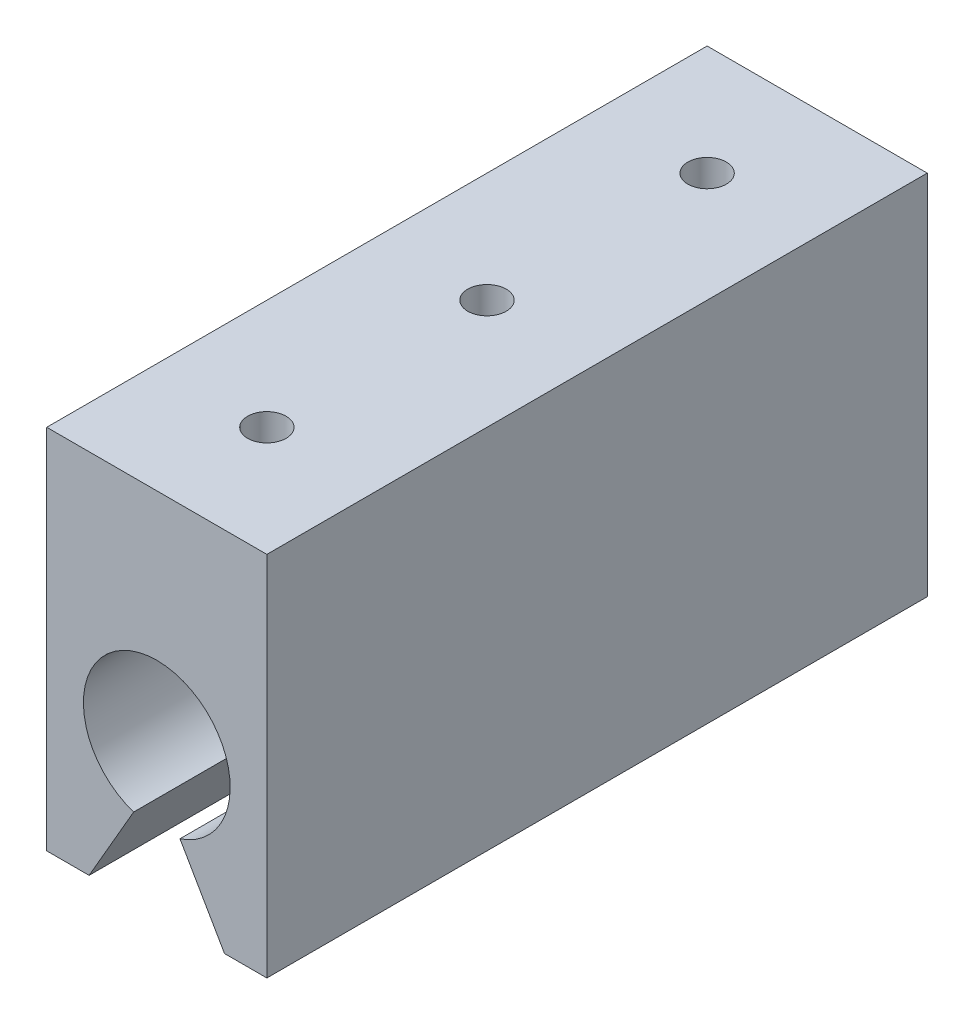
from build123d import *

# Parameters (mm, degrees)
BOSS_EXTRUDE1_DEPTH     = 114.3
SKETCH2_R               = 3.3274
CUT_EXTRUDE1_DEPTH      = 133.134940496
CUT_EXTRUDE2_REACH      = 128.523
CUT_EXTRUDE2_END_RADIUS = 12.7
SKETCH3_R               = 6.35


with BuildPart() as part:
    # Sketch1 → Boss-Extrude1 (new body)
    with BuildSketch(Plane.XY):
        with BuildLine():
            Line((4.010170085, 26.049749551), (11.717651581, 12.7))
            Line((11.717651581, 12.7), (19.05, 12.7))
            Line((19.05, 12.7), (19.05, 76.2))
            Line((19.05, 76.2), (-19.05, 76.2))
            Line((-19.05, 76.2), (-19.05, 12.7))
            Line((-19.05, 12.7), (-11.717651581, 12.7))
            Line((-11.717651581, 12.7), (-4.010170085, 26.049749551))
            ThreePointArc((-4.010170085, 26.049749551), (0, 50.8), (4.010170085, 26.049749551))
        make_face()
    extrude(amount=BOSS_EXTRUDE1_DEPTH)

    # Sketch2 → Cut-Extrude1 (cut, through all)
    with BuildSketch(Plane(origin=(0, 76.2, 0), x_dir=(1, 0, 0), z_dir=(0, 1, 0))):
        with Locations(Location((0, -19.05, 0), (0, 0, 270))):
            Circle(SKETCH2_R)
        with Locations(Location((0, -57.15, 0), (0, 0, 270))):
            Circle(SKETCH2_R)
        with Locations(Location((0, -95.25, 0), (0, 0, 270))):
            Circle(SKETCH2_R)
    extrude(amount=-CUT_EXTRUDE1_DEPTH, mode=Mode.SUBTRACT)

    # Cut-Extrude2: up to this cylinder (the profile starts outside it)
    cut_extrude2_end = Plane(origin=(0, 38.1, 57.15), z_dir=(0, 0, -1)) * Cylinder(CUT_EXTRUDE2_END_RADIUS, 359.646, mode=Mode.PRIVATE)
    # Sketch3 → Cut-Extrude2 (cut, up to the surface)
    with BuildSketch(Plane(origin=(0, 63.5, 0), x_dir=(1, 0, 0), z_dir=(0, 1, 0)), mode=Mode.PRIVATE) as cut_extrude2_sk1:
        with Locations(Location((0, -19.05, 0), (0, 0, 270))):
            Circle(SKETCH3_R)
    cut_extrude2_tool1 = extrude(cut_extrude2_sk1.sketch, amount=-CUT_EXTRUDE2_REACH, mode=Mode.PRIVATE) - cut_extrude2_end
    add(cut_extrude2_tool1.solids().sort_by_distance((0, 63.5, 19.05))[0], mode=Mode.SUBTRACT)
    # Sketch3 → Cut-Extrude2 (cut, up to the surface)
    with BuildSketch(Plane(origin=(0, 63.5, 0), x_dir=(1, 0, 0), z_dir=(0, 1, 0)), mode=Mode.PRIVATE) as cut_extrude2_sk2:
        with Locations(Location((0, -57.15, 0), (0, 0, 270))):
            Circle(SKETCH3_R)
    cut_extrude2_tool2 = extrude(cut_extrude2_sk2.sketch, amount=-CUT_EXTRUDE2_REACH, mode=Mode.PRIVATE) - cut_extrude2_end
    add(cut_extrude2_tool2.solids().sort_by_distance((0, 63.5, 57.15))[0], mode=Mode.SUBTRACT)
    # Sketch3 → Cut-Extrude2 (cut, up to the surface)
    with BuildSketch(Plane(origin=(0, 63.5, 0), x_dir=(1, 0, 0), z_dir=(0, 1, 0)), mode=Mode.PRIVATE) as cut_extrude2_sk3:
        with Locations(Location((0, -95.25, 0), (0, 0, 270))):
            Circle(SKETCH3_R)
    cut_extrude2_tool3 = extrude(cut_extrude2_sk3.sketch, amount=-CUT_EXTRUDE2_REACH, mode=Mode.PRIVATE) - cut_extrude2_end
    add(cut_extrude2_tool3.solids().sort_by_distance((0, 63.5, 95.25))[0], mode=Mode.SUBTRACT)


solid = part.part
